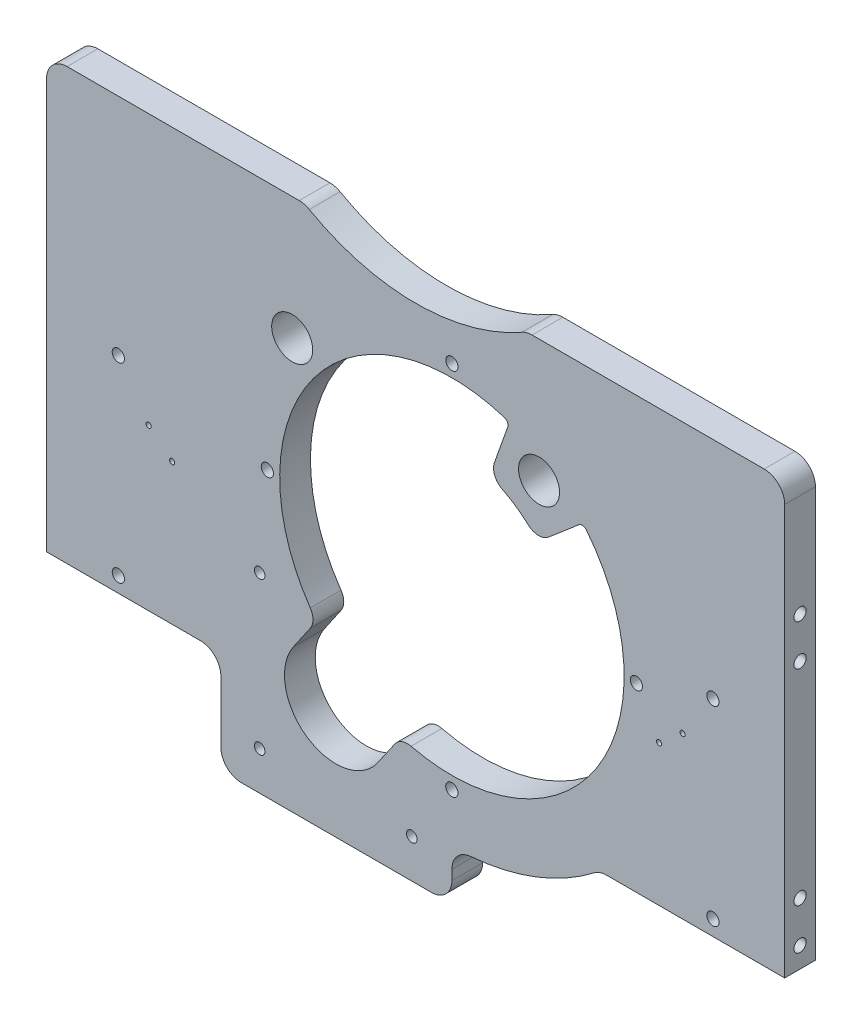
from build123d import *

# Parameters (mm, degrees)
SKETCH2_W                       = 228.6
SKETCH2_H                       = 165.1
BOSS_EXTRUDE1_DEPTH             = 9.525
F_1_2_0_5_DIAMETER_HOLE1_D      = 12.7
CUT_EXTRUDE2_DEPTH              = 169.325445566
CUT_EXTRUDE3_DEPTH              = 169.325445566
SKETCH7_R                       = 66.675
CUT_EXTRUDE4_DEPTH              = 169.325445566
SKETCH8_W                       = 53.975
SKETCH8_H                       = 31.75
CUT_EXTRUDE5_DEPTH              = 169.325445566
FILLET1_R                       = 4.7625
FILLET5_R                       = 6.35
F_10_24_TAPPED_HOLE1_AT_2_COUNT = 2
F_10_24_TAPPED_HOLE1_AT_2_PITCH = 12.7
F_10_24_TAPPED_HOLE1_AT_3_COUNT = 2
F_10_24_TAPPED_HOLE1_AT_3_PITCH = 76.2
F_10_24_TAPPED_HOLE1_AT_4_COUNT = 2
F_10_24_TAPPED_HOLE1_AT_4_PITCH = 88.9
FILLET6_R                       = 1.5875
M2X0_4_TAPPED_HOLE1_D           = 1.6
M4X0_7_TAPPED_HOLE1_D           = 3.3
F_10_24_TAPPED_HOLE2_D          = 3.7973


with BuildPart() as part:
    # Sketch2 → Boss-Extrude1 (new body)
    with BuildSketch(Plane.XY):
        with Locations((0, 40.65)):
            Rectangle(SKETCH2_W, SKETCH2_H)
    extrude(amount=BOSS_EXTRUDE1_DEPTH)

    # 1/2 (0.5) Diameter Hole1 (through all)
    with Locations(Plane.XY.offset(9.525)):
        with Locations((-38.227, 85.227), (38.227, 85.227)):
            Hole(F_1_2_0_5_DIAMETER_HOLE1_D / 2)

    # Sketch5 → Cut-Extrude2 (cut, through all)
    with BuildSketch(Plane.XY.offset(9.525)):
        with BuildLine():
            Line((29.060647703, 96.2613849), (22.908108615, 78.904585432))
            ThreePointArc((22.908108615, 78.904585432), (31.030333333, 74.762871327), (37.803845466, 68.660096262))
            Line((37.803845466, 68.660096262), (51.810500348, 80.615255985))
            ThreePointArc((51.810500348, 80.615255985), (-18.9865, 2.037177048), (29.060647703, 96.2613849))
        make_face()
    extrude(amount=-CUT_EXTRUDE2_DEPTH, mode=Mode.SUBTRACT)

    # Sketch6 → Cut-Extrude3 (cut, through all)
    with BuildSketch(Plane(origin=(0, 0, 0), x_dir=(-1, 0, 0), z_dir=(0, 0, -1))):
        with BuildLine():
            Line((26.309327508, 19.40431332), (37.823994175, 2.661707443))
            ThreePointArc((37.823994175, 2.661707443), (33.739666667, -19.414286732), (11.663672492, -15.329959224))
            Line((11.663672492, -15.329959224), (0.149005825, 1.412646653))
            ThreePointArc((0.149005825, 1.412646653), (4.233333333, 23.488640828), (26.309327508, 19.40431332))
        make_face()
    extrude(amount=-CUT_EXTRUDE3_DEPTH, mode=Mode.SUBTRACT)

    # Sketch7 → Cut-Extrude4 (cut, through all)
    with BuildSketch(Plane(origin=(0, 0, 0), x_dir=(-1, 0, 0), z_dir=(0, 0, -1))):
        with Locations((0, 180.35)):
            Circle(SKETCH7_R)
    extrude(amount=-CUT_EXTRUDE4_DEPTH, mode=Mode.SUBTRACT)

    # Sketch8 → Cut-Extrude5 (cut, through all)
    with BuildSketch(Plane.XY.offset(9.525)):
        with BuildLine():
            Line((114.3, -41.9), (114.3, -10.15))
            Line((114.3, -10.15), (56.945117879, -10.15))
            ThreePointArc((56.945117879, -10.15), (35.494289217, -22.219180967), (11.2395, -26.403482524))
            Line((11.2395, -26.403482524), (11.2395, -41.9))
            Line((11.2395, -41.9), (114.3, -41.9))
        make_face()
        with Locations((-87.3125, -26.025)):
            Rectangle(SKETCH8_W, SKETCH8_H)
    extrude(amount=-CUT_EXTRUDE5_DEPTH, mode=Mode.SUBTRACT)

    # Fillet1
    fillet1_edges = [part.edges().sort_by_distance(p)[0] for p in [
        (22.908108615, 78.904585432, 4.7625),
        (37.803845466, 68.660096262, 4.7625),
        (-30.696960997, 13.024587328, 4.7625),
        (-4.536639314, -4.967079339, 4.7625),
    ]]
    fillet(fillet1_edges, radius=FILLET1_R)

    # Fillet5
    fillet5_edges = [part.edges().sort_by_distance(p)[0] for p in [
        (-114.3, 123.2, 4.7625),
        (114.3, 123.2, 4.7625),
        (34.342875899, 123.2, 4.7625),
        (-34.342875899, 123.2, 4.7625),
        (56.945117879, -10.15, 4.7625),
        (11.2395, -26.403482524, 4.7625),
        (11.2395, -41.9, 4.7625),
        (-60.325, -41.9, 4.7625),
        (-60.325, -10.15, 4.7625),
    ]]
    fillet(fillet5_edges, radius=FILLET5_R)

    # Sketch16 → #10-24 Tapped Hole1 (revolve, cut)
    with BuildSketch(Plane(origin=(-114.3, 85.1, 4.7625), x_dir=(0, 0, 1), z_dir=(0, 1, 0))):
        Polygon((0, 0), (0, 16.088724014), (1.89865, 14.9479), (1.89865, 0), align=None)
    f_10_24_tapped_hole1 = revolve(axis=Axis((-120.65, 85.1, 4.7625), (1, 0, 0)), mode=Mode.SUBTRACT)

    # #10-24 Tapped Hole1 at 2: #10-24 Tapped Hole1 ×2
    with Locations(*[(0, -i * F_10_24_TAPPED_HOLE1_AT_2_PITCH, 0) for i in range(1, F_10_24_TAPPED_HOLE1_AT_2_COUNT)]):
        add(f_10_24_tapped_hole1, mode=Mode.SUBTRACT)

    # #10-24 Tapped Hole1 at 3: #10-24 Tapped Hole1 ×2
    with Locations(*[(0, -i * F_10_24_TAPPED_HOLE1_AT_3_PITCH, 0) for i in range(1, F_10_24_TAPPED_HOLE1_AT_3_COUNT)]):
        add(f_10_24_tapped_hole1, mode=Mode.SUBTRACT)

    # #10-24 Tapped Hole1 at 4: #10-24 Tapped Hole1 ×2
    with Locations(*[(0, -i * F_10_24_TAPPED_HOLE1_AT_4_PITCH, 0) for i in range(1, F_10_24_TAPPED_HOLE1_AT_4_COUNT)]):
        add(f_10_24_tapped_hole1, mode=Mode.SUBTRACT)

    # Mirror2: #10-24 Tapped Hole1 across plane
    add(f_10_24_tapped_hole1.mirror(Plane(origin=(0, 0, 0), x_dir=(0, 0, 1), z_dir=(1, 0, 0))), mode=Mode.SUBTRACT)

    # Mirror2 copy 1 sketch → Mirror2 copy 1 (revolve, cut)
    with BuildSketch(Plane(origin=(114.3, 72.4, 4.7625), x_dir=(0, 0, 1), z_dir=(0, 1, 0))):
        Polygon((0, 0), (0, -16.088724014), (1.89865, -14.9479), (1.89865, 0), align=None)
    revolve(axis=Axis((120.65, 72.4, 4.7625), (1, 0, 0)), mode=Mode.SUBTRACT)

    # Mirror2 copy 2 sketch → Mirror2 copy 2 (revolve, cut)
    with BuildSketch(Plane(origin=(114.3, 8.9, 4.7625), x_dir=(0, 0, 1), z_dir=(0, 1, 0))):
        Polygon((0, 0), (0, -16.088724014), (1.89865, -14.9479), (1.89865, 0), align=None)
    revolve(axis=Axis((120.65, 8.9, 4.7625), (1, 0, 0)), mode=Mode.SUBTRACT)

    # Mirror2 copy 3 sketch → Mirror2 copy 3 (revolve, cut)
    with BuildSketch(Plane(origin=(114.3, -3.8, 4.7625), x_dir=(0, 0, 1), z_dir=(0, 1, 0))):
        Polygon((0, 0), (0, -16.088724014), (1.89865, -14.9479), (1.89865, 0), align=None)
    revolve(axis=Axis((120.65, -3.8, 4.7625), (1, 0, 0)), mode=Mode.SUBTRACT)

    # Fillet6
    fillet6_edges = [part.edges().sort_by_distance(p)[0] for p in [
        (51.810500348, 80.615255985, 4.7625),
        (29.060647703, 96.2613849, 4.7625),
    ]]
    fillet(fillet6_edges, radius=FILLET6_R)

    # M2x0.4 Tapped Hole1 (through all)
    with Locations(Plane(origin=(0, 0, 0), x_dir=(-1, 0, 0), z_dir=(0, 0, -1))):
        with Locations((-75.40530211, 33.529936716), (-82.68272432, 39.636419008), (75.40530211, 33.529936716), (82.68272432, 39.636419008)):
            Hole(M2X0_4_TAPPED_HOLE1_D / 2)

    # M4x0.7 Tapped Hole1 (through all)
    with Locations(Plane.XY.offset(9.525)):
        with Locations((-48.313833333, 17.23587411), (-48.313833333, -29.90412589), (-1.173833333, -29.90412589)):
            Hole(M4X0_7_TAPPED_HOLE1_D / 2)

    # #10-24 Tapped Hole2 (through all)
    with Locations(Plane.XY.offset(9.525)):
        with Locations((-45.925717476, 45.9967), (11.2395, 103.136517476), (68.379317476, 45.9713), (11.2141, -11.168517476), (92.075, 53.6675), (92.075, -5.3875), (-92.075, -5.3875), (-92.075, 53.6675)):
            Hole(F_10_24_TAPPED_HOLE2_D / 2)


solid = part.part
